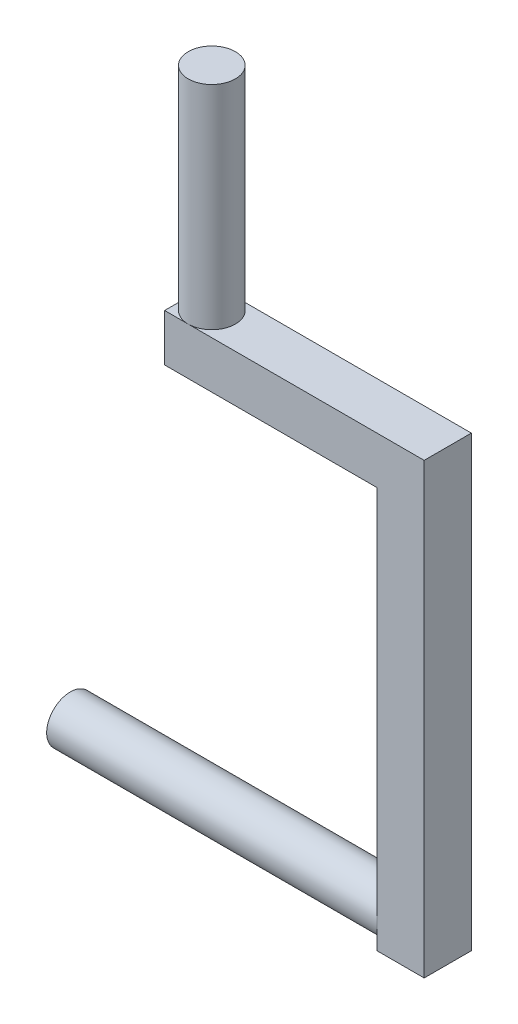
from build123d import *

# Parameters (mm, degrees)
SKETCH2_R           = 6.35
BOSS_EXTRUDE1_DEPTH = 57.15
SKETCH4_W           = 69.85
SKETCH4_H           = 12.7
BOSS_EXTRUDE6_DEPTH = 12.7
SKETCH8_W           = 12.7
SKETCH8_H           = 12.7
BOSS_EXTRUDE7_DEPTH = 107.95
SKETCH9_R           = 6.35
BOSS_EXTRUDE8_DEPTH = 88.9


with BuildPart() as part:
    # Sketch2 → Boss-Extrude1 (new body)
    with BuildSketch(Plane(origin=(0, 0, 0), x_dir=(1, 0, 0), z_dir=(0, 1, 0))):
        with Locations(Location((0, 0, 0), (0, 0, 270))):
            Circle(SKETCH2_R)
    extrude(amount=-BOSS_EXTRUDE1_DEPTH)

    # Sketch4 → Boss-Extrude6 (add)
    with BuildSketch(Plane.XZ.offset(57.15)):
        with Locations((28.575, 0)):
            Rectangle(SKETCH4_W, SKETCH4_H)
    extrude(amount=BOSS_EXTRUDE6_DEPTH)

    # Sketch8 → Boss-Extrude7 (add)
    with BuildSketch(Plane.XZ.offset(69.85)):
        with Locations((57.15, 0)):
            Rectangle(SKETCH8_W, SKETCH8_H)
    extrude(amount=BOSS_EXTRUDE7_DEPTH)

    # Sketch9 → Boss-Extrude8 (add)
    with BuildSketch(Plane.ZY.offset(-50.8)):
        with Locations((0, -171.45)):
            Circle(SKETCH9_R)
    extrude(amount=BOSS_EXTRUDE8_DEPTH)


solid = part.part
